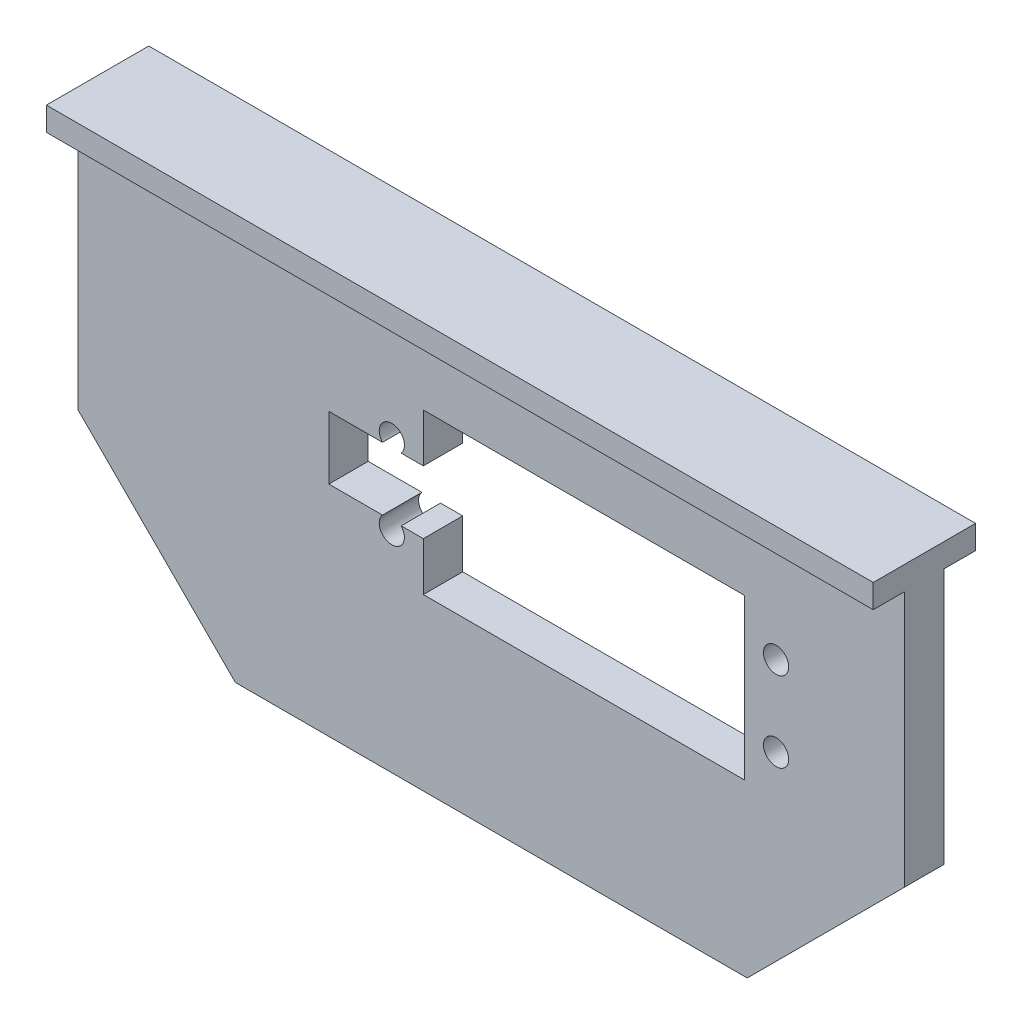
from build123d import *

# Parameters (mm, degrees)
SKETCH_1_W          = 105
SKETCH_1_H          = 52.5
SKETCH_1_R          = 1.6
SKETCH_1_W_2        = 40.8
SKETCH_1_H_2        = 20.3
EXTRUDE_1_DEPTH     = 5
SKETCH_3_W          = 13
SKETCH_3_H          = 3
EXTRUDE_2_DEPTH     = 105
SKETCH_4_W          = 24
SKETCH_4_H          = 8
CUT_EXTRUDE_1_DEPTH = 118.738056719
CHAMFER_1_SIZE      = 20


with BuildPart() as part:
    # 草图1 → 凸台-拉伸1 (new body)
    with BuildSketch(Plane.XY):
        with Locations((52.5, -26.25)):
            Rectangle(SKETCH_1_W, SKETCH_1_H)
        with Locations((39.864981543, -15.671828005)):
            Circle(SKETCH_1_R, mode=Mode.SUBTRACT)
        with Locations((39.864981543, -25.821828005)):
            Circle(SKETCH_1_R, mode=Mode.SUBTRACT)
        with Locations((88.664981543, -15.671828005)):
            Circle(SKETCH_1_R, mode=Mode.SUBTRACT)
        with Locations((88.664981543, -25.821828005)):
            Circle(SKETCH_1_R, mode=Mode.SUBTRACT)
        with Locations((64.264981543, -20.746828005)):
            Rectangle(SKETCH_1_W_2, SKETCH_1_H_2, mode=Mode.SUBTRACT)
    extrude(amount=EXTRUDE_1_DEPTH)

    # 草图3 → 凸台-拉伸2 (add, through all)
    with BuildSketch(Plane.ZY):
        with Locations((2.5, 1.5)):
            Rectangle(SKETCH_3_W, SKETCH_3_H)
    extrude(amount=-EXTRUDE_2_DEPTH)

    # 草图4 → 切除-拉伸1 (cut, through all)
    with BuildSketch(Plane.XY.offset(5)):
        with Locations((43.864981543, -20.746828005)):
            Rectangle(SKETCH_4_W, SKETCH_4_H)
    extrude(amount=-CUT_EXTRUDE_1_DEPTH, mode=Mode.SUBTRACT)

    # 倒角1
    chamfer_1_edges = [part.edges().sort_by_distance(p)[0] for p in [
        (105, -52.5, 2.5),
        (0, -52.5, 2.5),
    ]]
    chamfer(chamfer_1_edges, length=CHAMFER_1_SIZE)


solid = part.part
